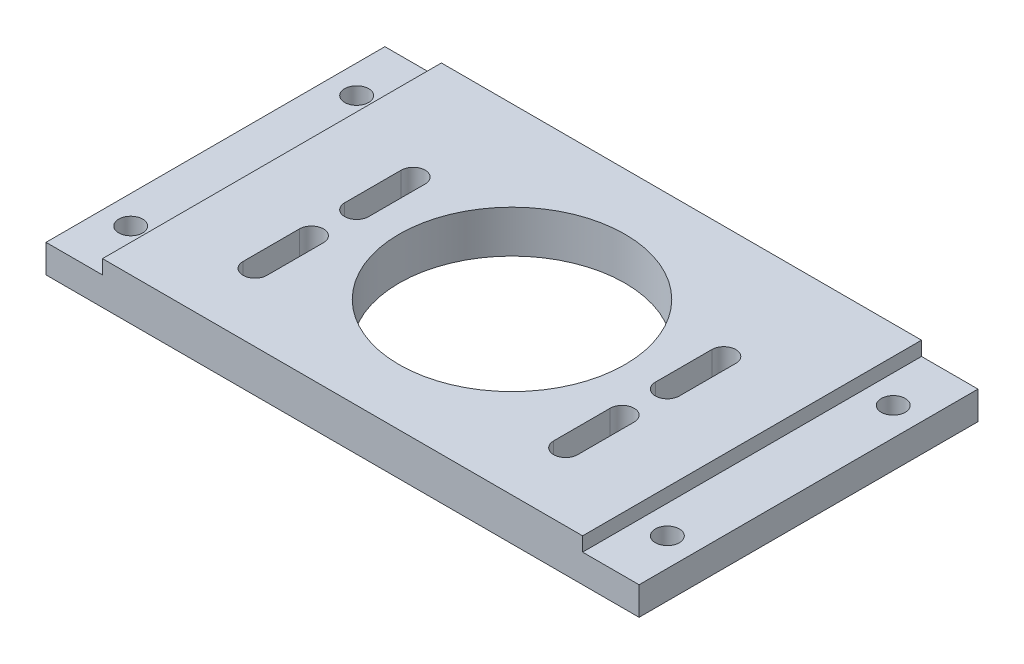
from build123d import *

# Parameters (mm, degrees)
EXTRUDE_1_DEPTH             = 120
HOLE_WIZARD_8_5_8_5_1_D     = 8.5
PATTERN_LINEAR_1_COUNT      = 2
PATTERN_LINEAR_1_PITCH      = 190
PATTERN_LINEAR_1_COUNT_DIR2 = 2
PATTERN_LINEAR_1_PITCH_DIR2 = 80
CUT_EXTRUDE_2_REACH         = 244.332
SKETCH_3_R                  = 40


with BuildPart() as part:
    # 草图1 → 拉伸1 (new body)
    with BuildSketch(Plane.XY):
        Polygon((0, 0), (210, 0), (210, 10), (190, 10), (190, 15), (20, 15), (20, 10), (0, 10), align=None)
    extrude(amount=EXTRUDE_1_DEPTH)

    # Ø8.5 (8.5) 直径孔1 (through all)
    with Locations(Plane(origin=(10, 0, 20), x_dir=(0, 0, -1), z_dir=(0, -1, 0))):
        with Locations((0, 0)):
            hole_wizard_8_5_8_5_1 = Hole(HOLE_WIZARD_8_5_8_5_1_D / 2)

    # 阵列(线性)1: Hole Wizard 8.5 _8.5_ _1 2 × 2
    with Locations(*[(i * PATTERN_LINEAR_1_PITCH, 0, j * PATTERN_LINEAR_1_PITCH_DIR2) for i in range(PATTERN_LINEAR_1_COUNT) for j in range(PATTERN_LINEAR_1_COUNT_DIR2) if (i, j) != (0, 0)]):
        add(hole_wizard_8_5_8_5_1, mode=Mode.SUBTRACT)

    # 草图3 → 拉伸2 (cut, up to next)
    with BuildSketch(Plane.XZ, mode=Mode.PRIVATE) as cut_extrude_2_sk1:
        with Locations(Location((105, 60, 0), (0, 0, 270))):
            Circle(SKETCH_3_R)
    cut_extrude_2_tool1 = extrude(cut_extrude_2_sk1.sketch, amount=-CUT_EXTRUDE_2_REACH, mode=Mode.PRIVATE) & part.part
    # 草图3 → 拉伸2 (cut, up to next)
    with BuildSketch(Plane.XZ, mode=Mode.PRIVATE) as cut_extrude_2_sk2:
        with BuildLine():
            Line((45.75, 96), (45.75, 76))
            ThreePointArc((45.75, 76), (50, 71.75), (54.25, 76))
            Line((54.25, 76), (54.25, 96))
            ThreePointArc((54.25, 96), (50, 100.25), (45.75, 96))
        make_face()
    cut_extrude_2_tool2 = extrude(cut_extrude_2_sk2.sketch, amount=-CUT_EXTRUDE_2_REACH, mode=Mode.PRIVATE) & part.part
    # 草图3 → 拉伸2 (cut, up to next)
    with BuildSketch(Plane.XZ, mode=Mode.PRIVATE) as cut_extrude_2_sk3:
        with BuildLine():
            Line((155.75, 96), (155.75, 76))
            ThreePointArc((155.75, 76), (160, 71.75), (164.25, 76))
            Line((164.25, 76), (164.25, 96))
            ThreePointArc((164.25, 96), (160, 100.25), (155.75, 96))
        make_face()
    cut_extrude_2_tool3 = extrude(cut_extrude_2_sk3.sketch, amount=-CUT_EXTRUDE_2_REACH, mode=Mode.PRIVATE) & part.part
    # 草图3 → 拉伸2 (cut, up to next)
    with BuildSketch(Plane.XZ, mode=Mode.PRIVATE) as cut_extrude_2_sk4:
        with BuildLine():
            Line((45.75, 60), (45.75, 40))
            ThreePointArc((45.75, 40), (50, 35.75), (54.25, 40))
            Line((54.25, 40), (54.25, 60))
            ThreePointArc((54.25, 60), (50, 64.25), (45.75, 60))
        make_face()
    cut_extrude_2_tool4 = extrude(cut_extrude_2_sk4.sketch, amount=-CUT_EXTRUDE_2_REACH, mode=Mode.PRIVATE) & part.part
    # 草图3 → 拉伸2 (cut, up to next)
    with BuildSketch(Plane.XZ, mode=Mode.PRIVATE) as cut_extrude_2_sk5:
        with BuildLine():
            Line((155.75, 60), (155.75, 40))
            ThreePointArc((155.75, 40), (160, 35.75), (164.25, 40))
            Line((164.25, 40), (164.25, 60))
            ThreePointArc((164.25, 60), (160, 64.25), (155.75, 60))
        make_face()
    cut_extrude_2_tool5 = extrude(cut_extrude_2_sk5.sketch, amount=-CUT_EXTRUDE_2_REACH, mode=Mode.PRIVATE) & part.part
    add(cut_extrude_2_tool1.solids().sort_by_distance((105, 0, 60))[0], mode=Mode.SUBTRACT)
    add(cut_extrude_2_tool2.solids().sort_by_distance((50, 0, 86))[0], mode=Mode.SUBTRACT)
    add(cut_extrude_2_tool3.solids().sort_by_distance((160, 0, 86))[0], mode=Mode.SUBTRACT)
    add(cut_extrude_2_tool4.solids().sort_by_distance((50, 0, 50))[0], mode=Mode.SUBTRACT)
    add(cut_extrude_2_tool5.solids().sort_by_distance((160, 0, 50))[0], mode=Mode.SUBTRACT)


solid = part.part
